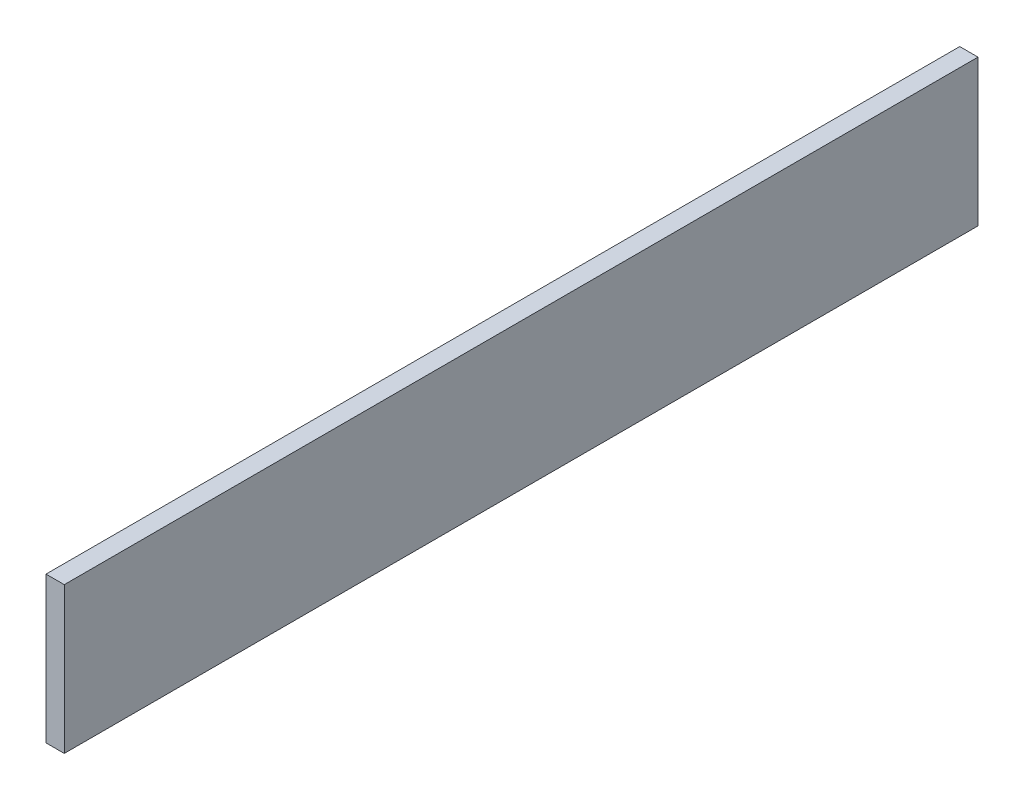
from build123d import *

# Parameters (mm, degrees)
SKETCH1_W           = 10
SKETCH1_H           = 80
BOSS_EXTRUDE1_DEPTH = 500


with BuildPart() as part:
    # Sketch1 → Boss-Extrude1 (new body)
    with BuildSketch(Plane.XY):
        with Locations((3, 50)):
            Rectangle(SKETCH1_W, SKETCH1_H)
    extrude(amount=BOSS_EXTRUDE1_DEPTH)


solid = part.part
